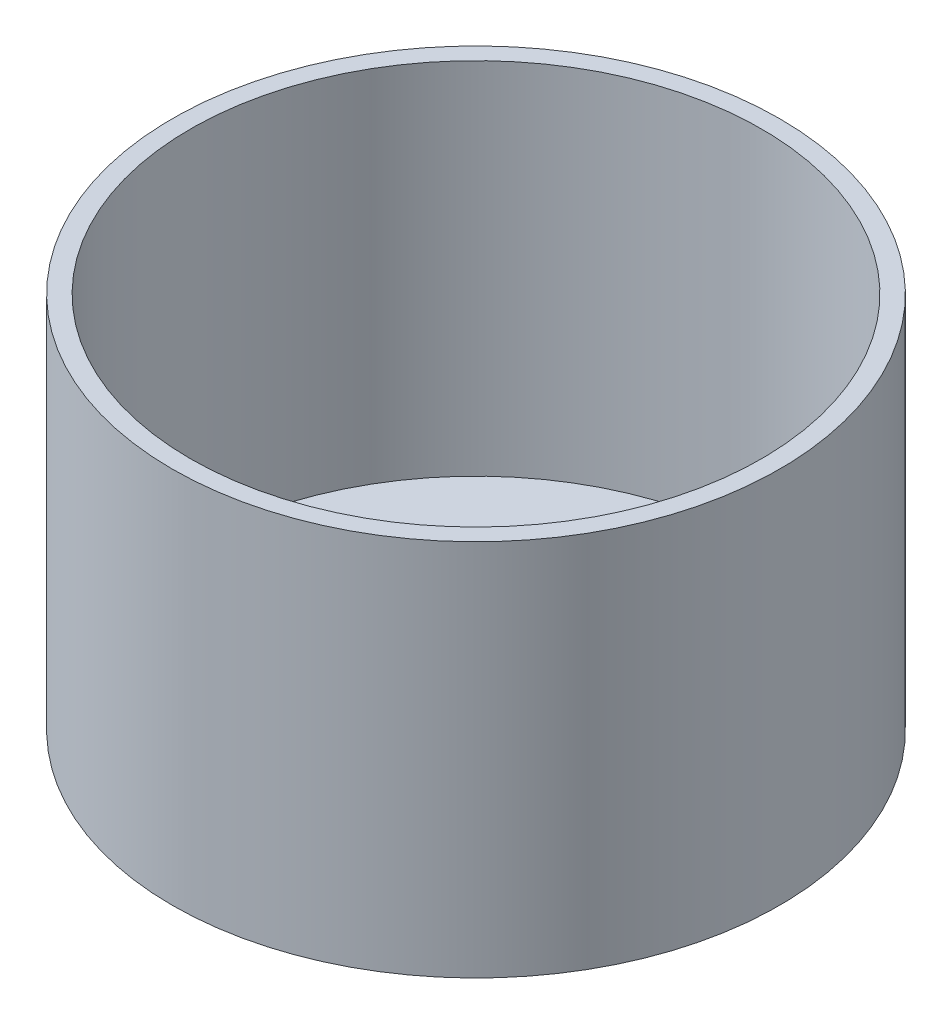
from build123d import *

# Parameters (mm, degrees)
SKETCH1_R           = 33.75
BOSS_EXTRUDE1_DEPTH = 2
SKETCH2_R           = 33.75
SKETCH2_R_2         = 31.75
BOSS_EXTRUDE2_DEPTH = 40


with BuildPart() as part:
    # Sketch1 → Boss-Extrude1 (new body)
    with BuildSketch(Plane(origin=(0, 0, 0), x_dir=(1, 0, 0), z_dir=(0, 1, 0))):
        with Locations(Location((0, 0, 0), (0, 0, 270))):
            Circle(SKETCH1_R)
    extrude(amount=BOSS_EXTRUDE1_DEPTH)

    # Sketch2 → Boss-Extrude2 (add)
    with BuildSketch(Plane(origin=(0, 2, 0), x_dir=(1, 0, 0), z_dir=(0, 1, 0))):
        with Locations(Location((0, 0, 0), (0, 0, 270))):
            Circle(SKETCH2_R)
        with Locations(Location((0, 0, 0), (0, 0, 270))):
            Circle(SKETCH2_R_2, mode=Mode.SUBTRACT)
    extrude(amount=BOSS_EXTRUDE2_DEPTH)


solid = part.part
